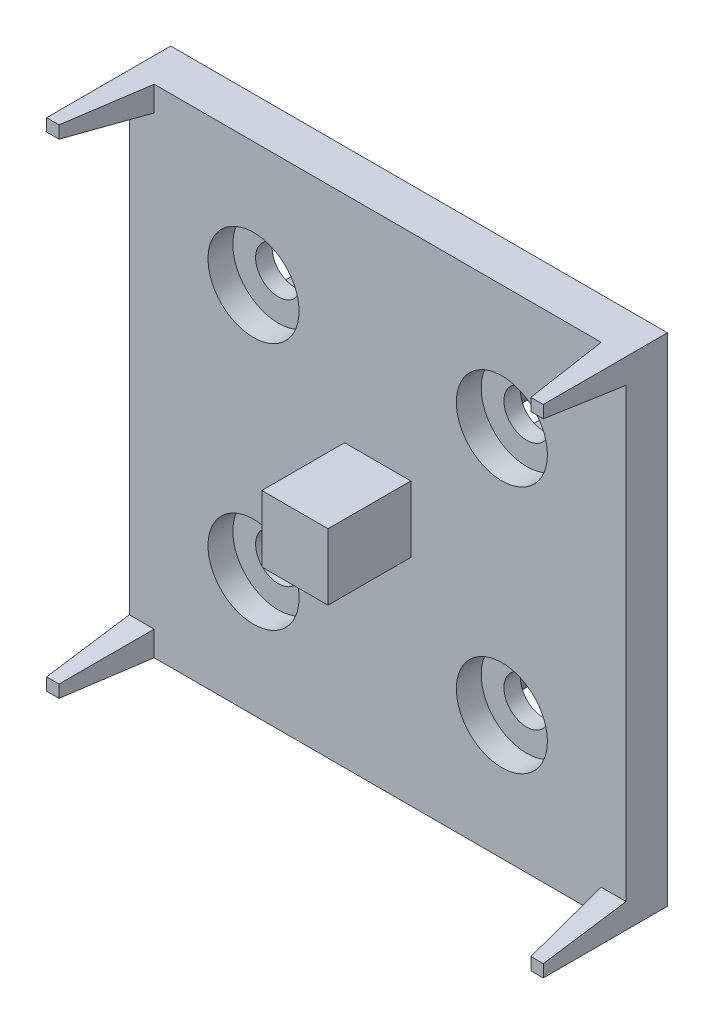
from build123d import *

# Parameters (mm, degrees)
SKETCH_1_W                   = 60
SKETCH_1_H                   = 60
EXTRUDE_1_DEPTH              = 5
SKETCH_3_W                   = 3
SKETCH_3_H                   = 3
EXTRUDE_3_DEPTH              = 10
CUT_EXTRUDE_1_DEPTH          = 67.136223055
CUT_EXTRUDE_2_DEPTH          = 10
PATTERN_CIRCULAR_1_COUNT     = 4
HOLE_WIZARD_M5_2_D           = 5.5
HOLE_WIZARD_M5_2_CBORE_D     = 11
HOLE_WIZARD_M5_2_CBORE_DEPTH = 3
EXTRUDE_4_DEPTH              = 10
CHAMFER_1_SIZE               = 1.5
SKETCH_10_W                  = 8
SKETCH_10_H                  = 8
EXTRUDE_5_DEPTH              = 10


with BuildPart() as part:
    # 스케치1 → 보스-돌출1 (new body)
    with BuildSketch(Plane.XY):
        Rectangle(SKETCH_1_W, SKETCH_1_H)
    extrude(amount=EXTRUDE_1_DEPTH)

    # 스케치3 → 보스-돌출3 (add)
    with BuildSketch(Plane.XY.offset(5)):
        with Locations((-28.5, -28.5)):
            Rectangle(SKETCH_3_W, SKETCH_3_H)
    extrude_3 = extrude(amount=EXTRUDE_3_DEPTH)

    # 스케치4 → 컷-돌출1 (cut, through all)
    with BuildSketch(Plane(origin=(-27, 0, 0), x_dir=(0, 0, -1), z_dir=(1, 0, 0))):
        Polygon((-15, -27), (-15, -28.5), (-5, -27), align=None)
    cut_extrude_1 = extrude(amount=-CUT_EXTRUDE_1_DEPTH, mode=Mode.SUBTRACT)

    # 스케치5 → 컷-돌출2 (cut)
    with BuildSketch(Plane.XZ.offset(30)):
        Polygon((-28.5, 15), (-27, 15), (-27, 5), align=None)
    cut_extrude_2 = extrude(amount=-CUT_EXTRUDE_2_DEPTH, mode=Mode.SUBTRACT)

    # 원형 패턴1: 보스-돌출3, 컷-돌출1, 컷-돌출2 ×4 about axis
    pattern_circular_1_axis = Axis((0, 0, 0), (0, 0, 1))
    add([extrude_3.rotate(pattern_circular_1_axis, i * 360 / PATTERN_CIRCULAR_1_COUNT) for i in range(1, PATTERN_CIRCULAR_1_COUNT)])
    add([cut_extrude_1.rotate(pattern_circular_1_axis, i * 360 / PATTERN_CIRCULAR_1_COUNT) for i in range(1, PATTERN_CIRCULAR_1_COUNT)], mode=Mode.SUBTRACT)
    add([cut_extrude_2.rotate(pattern_circular_1_axis, i * 360 / PATTERN_CIRCULAR_1_COUNT) for i in range(1, PATTERN_CIRCULAR_1_COUNT)], mode=Mode.SUBTRACT)

    # M5 소켓 머리 캡 나사용 카운터보어2 (through all)
    with Locations(Plane.XY.offset(5)):
        with Locations((-15, 15), (15, 15), (15, -15), (-15, -15)):
            CounterBoreHole(HOLE_WIZARD_M5_2_D / 2, HOLE_WIZARD_M5_2_CBORE_D / 2, HOLE_WIZARD_M5_2_CBORE_DEPTH)

    # 스케치9 → 보스-돌출4 (add)
    with BuildSketch(Plane(origin=(0, 0, 0), x_dir=(-1, 0, 0), z_dir=(0, 0, -1))):
        with BuildLine():
            Line((-20.05, 2.5), (-20.05, 8.545042831))
            ThreePointArc((-20.05, 8.545042831), (-15, 10.5), (-9.95, 8.545042831))
            Line((-9.95, 8.545042831), (-9.95, 2.5))
            Line((-9.95, 2.5), (-11.95, 2.5))
            Line((-11.95, 2.5), (-11.95, -2.5))
            Line((-11.95, -2.5), (-9.95, -2.5))
            Line((-9.95, -2.5), (-9.95, -8.545042831))
            ThreePointArc((-9.95, -8.545042831), (-15, -10.5), (-20.05, -8.545042831))
            Line((-20.05, -8.545042831), (-20.05, -2.5))
            Line((-20.05, -2.5), (-18.05, -2.5))
            Line((-18.05, -2.5), (-18.05, 2.5))
            Line((-18.05, 2.5), (-20.05, 2.5))
        make_face()
        with BuildLine():
            Line((2.5, 20.05), (8.545042831, 20.05))
            ThreePointArc((8.545042831, 20.05), (10.5, 15), (8.545042831, 9.95))
            Line((8.545042831, 9.95), (2.5, 9.95))
            Line((2.5, 9.95), (2.5, 11.95))
            Line((2.5, 11.95), (-2.5, 11.95))
            Line((-2.5, 11.95), (-2.5, 9.95))
            Line((-2.5, 9.95), (-8.545042831, 9.95))
            ThreePointArc((-8.545042831, 9.95), (-10.5, 15), (-8.545042831, 20.05))
            Line((-8.545042831, 20.05), (-2.5, 20.05))
            Line((-2.5, 20.05), (-2.5, 18.05))
            Line((-2.5, 18.05), (2.5, 18.05))
            Line((2.5, 18.05), (2.5, 20.05))
        make_face()
        with BuildLine():
            Line((20.05, -2.5), (20.05, -8.545042831))
            ThreePointArc((20.05, -8.545042831), (15, -10.5), (9.95, -8.545042831))
            Line((9.95, -8.545042831), (9.95, -2.5))
            Line((9.95, -2.5), (11.95, -2.5))
            Line((11.95, -2.5), (11.95, 2.5))
            Line((11.95, 2.5), (9.95, 2.5))
            Line((9.95, 2.5), (9.95, 8.545042831))
            ThreePointArc((9.95, 8.545042831), (15, 10.5), (20.05, 8.545042831))
            Line((20.05, 8.545042831), (20.05, 2.5))
            Line((20.05, 2.5), (18.05, 2.5))
            Line((18.05, 2.5), (18.05, -2.5))
            Line((18.05, -2.5), (20.05, -2.5))
        make_face()
        with BuildLine():
            Line((-2.5, -20.05), (-8.545042831, -20.05))
            ThreePointArc((-8.545042831, -20.05), (-10.5, -15), (-8.545042831, -9.95))
            Line((-8.545042831, -9.95), (-2.5, -9.95))
            Line((-2.5, -9.95), (-2.5, -11.95))
            Line((-2.5, -11.95), (2.5, -11.95))
            Line((2.5, -11.95), (2.5, -9.95))
            Line((2.5, -9.95), (8.545042831, -9.95))
            ThreePointArc((8.545042831, -9.95), (10.5, -15), (8.545042831, -20.05))
            Line((8.545042831, -20.05), (2.5, -20.05))
            Line((2.5, -20.05), (2.5, -18.05))
            Line((2.5, -18.05), (-2.5, -18.05))
            Line((-2.5, -18.05), (-2.5, -20.05))
        make_face()
    extrude(amount=EXTRUDE_4_DEPTH)

    # 모따기1
    chamfer_1_edges = [part.edges().sort_by_distance(p)[0] for p in [
        (15, -10.5, -10),
        (9.95, -5.522521416, -10),
        (10.95, -2.5, -10),
        (11.95, 0, -10),
        (10.95, 2.5, -10),
        (9.95, 5.522521416, -10),
        (15, 10.5, -10),
        (20.05, 5.522521416, -10),
        (19.05, 2.5, -10),
        (18.05, 0, -10),
        (19.05, -2.5, -10),
        (20.05, -5.522521416, -10),
        (10.5, 15, -10),
        (5.522521416, 9.95, -10),
        (2.5, 10.95, -10),
        (0, 11.95, -10),
        (-2.5, 10.95, -10),
        (-5.522521416, 9.95, -10),
        (-10.5, 15, -10),
        (-5.522521416, 20.05, -10),
        (-2.5, 19.05, -10),
        (0, 18.05, -10),
        (2.5, 19.05, -10),
        (5.522521416, 20.05, -10),
        (-15, 10.5, -10),
        (-9.95, 5.522521416, -10),
        (-10.95, 2.5, -10),
        (-11.95, 0, -10),
        (-10.95, -2.5, -10),
        (-9.95, -5.522521416, -10),
        (-15, -10.5, -10),
        (-20.05, -5.522521416, -10),
        (-19.05, -2.5, -10),
        (-18.05, 0, -10),
        (-19.05, 2.5, -10),
        (-20.05, 5.522521416, -10),
        (-10.5, -15, -10),
        (-5.522521416, -9.95, -10),
        (-2.5, -10.95, -10),
        (0, -11.95, -10),
        (2.5, -10.95, -10),
        (5.522521416, -9.95, -10),
        (10.5, -15, -10),
        (5.522521416, -20.05, -10),
        (2.5, -19.05, -10),
        (0, -18.05, -10),
        (-2.5, -19.05, -10),
        (-5.522521416, -20.05, -10),
    ]]
    chamfer(chamfer_1_edges, length=CHAMFER_1_SIZE)

    # 스케치10 → 보스-돌출5 (add)
    with BuildSketch(Plane.XY.offset(5)):
        Rectangle(SKETCH_10_W, SKETCH_10_H)
    extrude(amount=EXTRUDE_5_DEPTH)


solid = part.part
